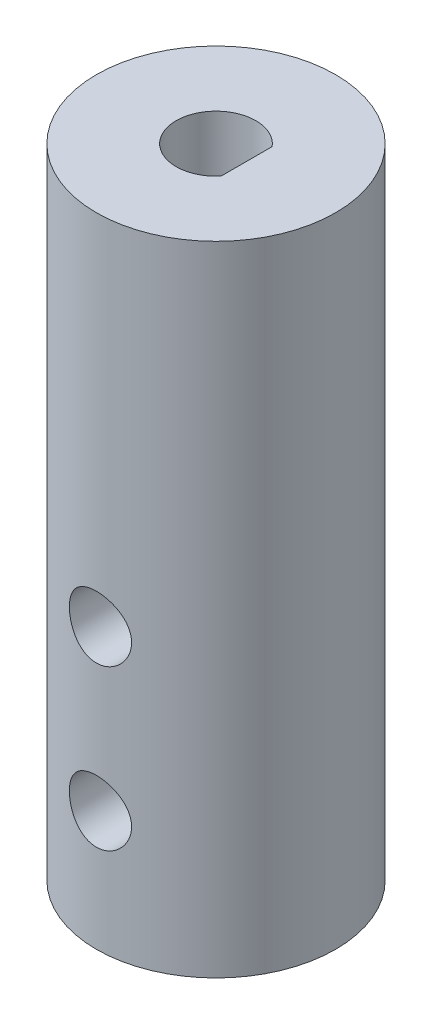
from build123d import *

# Parameters (mm, degrees)
SKETCH1_R           = 9.525
BOSS_EXTRUDE1_DEPTH = 50.8
SKETCH2_R           = 2.4765
CUT_EXTRUDE1_DEPTH  = 56.084191244


with BuildPart() as part:
    # Sketch1 → Boss-Extrude1 (new body)
    with BuildSketch(Plane(origin=(0, 0, 0), x_dir=(1, 0, 0), z_dir=(0, 1, 0))):
        with Locations(Location((0, 0, 0), (0, 0, 270))):
            Circle(SKETCH1_R)
        with BuildLine():
            Line((2.439590334, 2.032), (2.439590334, -2.032))
            ThreePointArc((2.439590334, -2.032), (-3.175, 0), (2.439590334, 2.032))
        make_face(mode=Mode.SUBTRACT)
    extrude(amount=BOSS_EXTRUDE1_DEPTH)

    # Sketch2 → Cut-Extrude1 (cut, through all)
    with BuildSketch(Plane.XY.offset(9.525)):
        with Locations(Location((0, 9.525, 0), (0, 0, 89.999999987))):
            Circle(SKETCH2_R)
        with Locations(Location((0, 22.225, 0), (0, 0, 89.999999987))):
            Circle(SKETCH2_R)
    extrude(amount=-CUT_EXTRUDE1_DEPTH, mode=Mode.SUBTRACT)


solid = part.part
